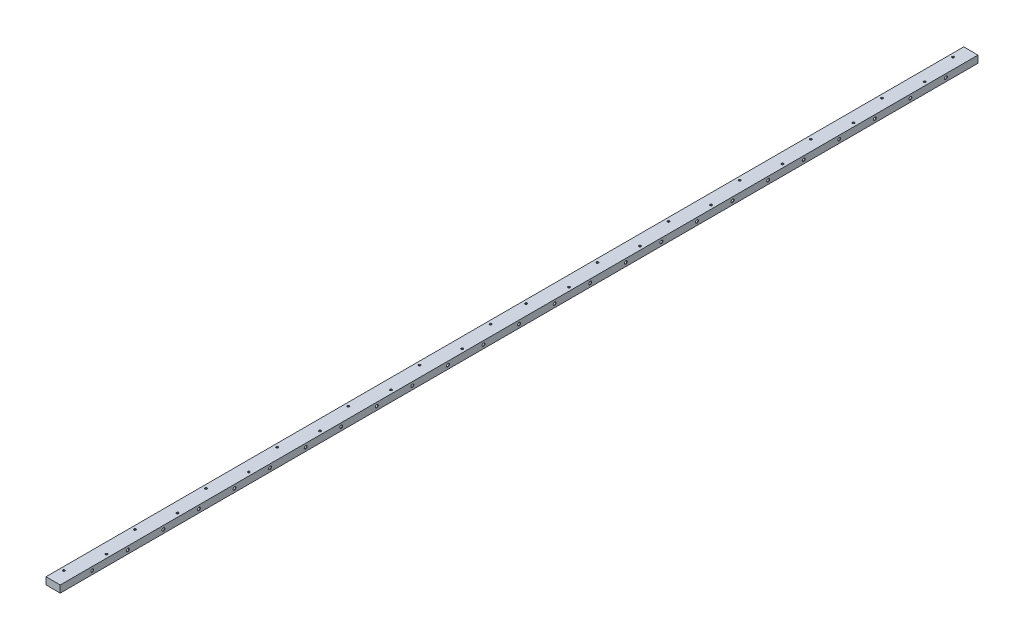
from build123d import *

# Parameters (mm, degrees)
SKETCH1_W                      = 20
SKETCH1_H                      = 10
BOSS_EXTRUDE1_DEPTH            = 645
M3X0_5_TAPPED_HOLE1_AT_2_COUNT = 2
M3X0_5_TAPPED_HOLE1_AT_2_PITCH = 50.990195136
LPATTERN1_COUNT                = 7
LPATTERN1_PITCH                = 100
LPATTERN2_COUNT                = 13
LPATTERN2_PITCH                = 50
LPATTERN2_COL_COUNT            = 13
LPATTERN2_COL_PITCH            = 50


with BuildPart() as part:
    # Sketch1 → Boss-Extrude1 (new, symmetric)
    with BuildSketch(Plane.XY):
        Rectangle(SKETCH1_W, SKETCH1_H)
    extrude(amount=BOSS_EXTRUDE1_DEPTH, both=True)

    # Sketch7 → M3x0.5 Tapped Hole1 (revolve, cut)
    with BuildSketch(Plane(origin=(-5, 5, 25), x_dir=(0, 0, 1), z_dir=(1, 0, 0))):
        Polygon((0, 0), (0, 8.751075774), (1.25, 8), (1.25, 0.66390873), (1.525, 0), align=None)
    m3x0_5_tapped_hole1 = revolve(axis=Axis((-5, 11.35, 25), (0, -1, 0)), mode=Mode.SUBTRACT)

    # M3x0.5 Tapped Hole1 at 2: M3x0.5 Tapped Hole1 ×2
    with Locations(*[Vector(0.1961161351381841, 0, 0.9805806756909201) * (i * M3X0_5_TAPPED_HOLE1_AT_2_PITCH) for i in range(1, M3X0_5_TAPPED_HOLE1_AT_2_COUNT)]):
        add(m3x0_5_tapped_hole1, mode=Mode.SUBTRACT)

    # LPattern1: M3x0.5 Tapped Hole1 ×7
    with Locations(*[(0, 0, i * LPATTERN1_PITCH) for i in range(1, LPATTERN1_COUNT)]):
        add(m3x0_5_tapped_hole1, mode=Mode.SUBTRACT)

    # LPattern1 copy 1 sketch → LPattern1 copy 1 (revolve, cut)
    with BuildSketch(Plane(origin=(5, 5, 175), x_dir=(0, 0, 1), z_dir=(1, 0, 0))):
        Polygon((0, 0), (0, 8.751075774), (1.25, 8), (1.25, 0.66390873), (1.525, 0), align=None)
    revolve(axis=Axis((5, 11.35, 175), (0, -1, 0)), mode=Mode.SUBTRACT)

    # LPattern1 copy 2 sketch → LPattern1 copy 2 (revolve, cut)
    with BuildSketch(Plane(origin=(5, 5, 275), x_dir=(0, 0, 1), z_dir=(1, 0, 0))):
        Polygon((0, 0), (0, 8.751075774), (1.25, 8), (1.25, 0.66390873), (1.525, 0), align=None)
    revolve(axis=Axis((5, 11.35, 275), (0, -1, 0)), mode=Mode.SUBTRACT)

    # LPattern1 copy 3 sketch → LPattern1 copy 3 (revolve, cut)
    with BuildSketch(Plane(origin=(5, 5, 375), x_dir=(0, 0, 1), z_dir=(1, 0, 0))):
        Polygon((0, 0), (0, 8.751075774), (1.25, 8), (1.25, 0.66390873), (1.525, 0), align=None)
    revolve(axis=Axis((5, 11.35, 375), (0, -1, 0)), mode=Mode.SUBTRACT)

    # LPattern1 copy 4 sketch → LPattern1 copy 4 (revolve, cut)
    with BuildSketch(Plane(origin=(5, 5, 475), x_dir=(0, 0, 1), z_dir=(1, 0, 0))):
        Polygon((0, 0), (0, 8.751075774), (1.25, 8), (1.25, 0.66390873), (1.525, 0), align=None)
    revolve(axis=Axis((5, 11.35, 475), (0, -1, 0)), mode=Mode.SUBTRACT)

    # LPattern1 copy 5 sketch → LPattern1 copy 5 (revolve, cut)
    with BuildSketch(Plane(origin=(5, 5, 575), x_dir=(0, 0, 1), z_dir=(1, 0, 0))):
        Polygon((0, 0), (0, 8.751075774), (1.25, 8), (1.25, 0.66390873), (1.525, 0), align=None)
    revolve(axis=Axis((5, 11.35, 575), (0, -1, 0)), mode=Mode.SUBTRACT)

    # LPattern1 copy 6 sketch → LPattern1 copy 6 (revolve, cut)
    with BuildSketch(Plane(origin=(5, 5, 675), x_dir=(0, 0, 1), z_dir=(1, 0, 0))):
        Polygon((0, 0), (0, 8.751075774), (1.25, 8), (1.25, 0.66390873), (1.525, 0), align=None)
    revolve(axis=Axis((5, 11.35, 675), (0, -1, 0)), mode=Mode.SUBTRACT)

    # Mirror1: M3x0.5 Tapped Hole1 across plane
    add(m3x0_5_tapped_hole1.mirror(Plane.XY), mode=Mode.SUBTRACT)

    # Mirror1 copy 1 sketch → Mirror1 copy 1 (revolve, cut)
    with BuildSketch(Plane(origin=(5, 5, -75), x_dir=(0, 0, -1), z_dir=(1, 0, 0))):
        Polygon((0, 0), (0, -8.751075774), (1.25, -8), (1.25, -0.66390873), (1.525, 0), align=None)
    revolve(axis=Axis((5, 11.35, -75), (0, 1, 0)), mode=Mode.SUBTRACT)

    # Mirror1 copy 2 sketch → Mirror1 copy 2 (revolve, cut)
    with BuildSketch(Plane(origin=(-5, 5, -125), x_dir=(0, 0, -1), z_dir=(1, 0, 0))):
        Polygon((0, 0), (0, -8.751075774), (1.25, -8), (1.25, -0.66390873), (1.525, 0), align=None)
    revolve(axis=Axis((-5, 11.35, -125), (0, 1, 0)), mode=Mode.SUBTRACT)

    # Mirror1 copy 3 sketch → Mirror1 copy 3 (revolve, cut)
    with BuildSketch(Plane(origin=(-5, 5, -225), x_dir=(0, 0, -1), z_dir=(1, 0, 0))):
        Polygon((0, 0), (0, -8.751075774), (1.25, -8), (1.25, -0.66390873), (1.525, 0), align=None)
    revolve(axis=Axis((-5, 11.35, -225), (0, 1, 0)), mode=Mode.SUBTRACT)

    # Mirror1 copy 4 sketch → Mirror1 copy 4 (revolve, cut)
    with BuildSketch(Plane(origin=(-5, 5, -325), x_dir=(0, 0, -1), z_dir=(1, 0, 0))):
        Polygon((0, 0), (0, -8.751075774), (1.25, -8), (1.25, -0.66390873), (1.525, 0), align=None)
    revolve(axis=Axis((-5, 11.35, -325), (0, 1, 0)), mode=Mode.SUBTRACT)

    # Mirror1 copy 5 sketch → Mirror1 copy 5 (revolve, cut)
    with BuildSketch(Plane(origin=(-5, 5, -425), x_dir=(0, 0, -1), z_dir=(1, 0, 0))):
        Polygon((0, 0), (0, -8.751075774), (1.25, -8), (1.25, -0.66390873), (1.525, 0), align=None)
    revolve(axis=Axis((-5, 11.35, -425), (0, 1, 0)), mode=Mode.SUBTRACT)

    # Mirror1 copy 6 sketch → Mirror1 copy 6 (revolve, cut)
    with BuildSketch(Plane(origin=(-5, 5, -525), x_dir=(0, 0, -1), z_dir=(1, 0, 0))):
        Polygon((0, 0), (0, -8.751075774), (1.25, -8), (1.25, -0.66390873), (1.525, 0), align=None)
    revolve(axis=Axis((-5, 11.35, -525), (0, 1, 0)), mode=Mode.SUBTRACT)

    # Mirror1 copy 7 sketch → Mirror1 copy 7 (revolve, cut)
    with BuildSketch(Plane(origin=(-5, 5, -625), x_dir=(0, 0, -1), z_dir=(1, 0, 0))):
        Polygon((0, 0), (0, -8.751075774), (1.25, -8), (1.25, -0.66390873), (1.525, 0), align=None)
    revolve(axis=Axis((-5, 11.35, -625), (0, 1, 0)), mode=Mode.SUBTRACT)

    # Mirror1 copy 8 sketch → Mirror1 copy 8 (revolve, cut)
    with BuildSketch(Plane(origin=(5, 5, -175), x_dir=(0, 0, -1), z_dir=(1, 0, 0))):
        Polygon((0, 0), (0, -8.751075774), (1.25, -8), (1.25, -0.66390873), (1.525, 0), align=None)
    revolve(axis=Axis((5, 11.35, -175), (0, 1, 0)), mode=Mode.SUBTRACT)

    # Mirror1 copy 9 sketch → Mirror1 copy 9 (revolve, cut)
    with BuildSketch(Plane(origin=(5, 5, -275), x_dir=(0, 0, -1), z_dir=(1, 0, 0))):
        Polygon((0, 0), (0, -8.751075774), (1.25, -8), (1.25, -0.66390873), (1.525, 0), align=None)
    revolve(axis=Axis((5, 11.35, -275), (0, 1, 0)), mode=Mode.SUBTRACT)

    # Mirror1 copy 10 sketch → Mirror1 copy 10 (revolve, cut)
    with BuildSketch(Plane(origin=(5, 5, -375), x_dir=(0, 0, -1), z_dir=(1, 0, 0))):
        Polygon((0, 0), (0, -8.751075774), (1.25, -8), (1.25, -0.66390873), (1.525, 0), align=None)
    revolve(axis=Axis((5, 11.35, -375), (0, 1, 0)), mode=Mode.SUBTRACT)

    # Mirror1 copy 11 sketch → Mirror1 copy 11 (revolve, cut)
    with BuildSketch(Plane(origin=(5, 5, -475), x_dir=(0, 0, -1), z_dir=(1, 0, 0))):
        Polygon((0, 0), (0, -8.751075774), (1.25, -8), (1.25, -0.66390873), (1.525, 0), align=None)
    revolve(axis=Axis((5, 11.35, -475), (0, 1, 0)), mode=Mode.SUBTRACT)

    # Mirror1 copy 12 sketch → Mirror1 copy 12 (revolve, cut)
    with BuildSketch(Plane(origin=(5, 5, -575), x_dir=(0, 0, -1), z_dir=(1, 0, 0))):
        Polygon((0, 0), (0, -8.751075774), (1.25, -8), (1.25, -0.66390873), (1.525, 0), align=None)
    revolve(axis=Axis((5, 11.35, -575), (0, 1, 0)), mode=Mode.SUBTRACT)

    # Mirror1 copy 13 sketch → Mirror1 copy 13 (revolve, cut)
    with BuildSketch(Plane(origin=(5, 5, -675), x_dir=(0, 0, -1), z_dir=(1, 0, 0))):
        Polygon((0, 0), (0, -8.751075774), (1.25, -8), (1.25, -0.66390873), (1.525, 0), align=None)
    revolve(axis=Axis((5, 11.35, -675), (0, 1, 0)), mode=Mode.SUBTRACT)

    # Sketch9 → M4x0.7 Tapped Hole1 (revolve, cut)
    with BuildSketch(Plane(origin=(-10, 0, 0), x_dir=(0, 0, 1), z_dir=(0, 1, 0))):
        Polygon((0, 0), (0, 20), (2.05, 20), (1.65, 19.6), (1.65, 0.4), (2.05, 0), align=None)
    m4x0_7_tapped_hole1 = revolve(axis=Axis((-16.35, 0, 0), (1, 0, 0)), mode=Mode.SUBTRACT)

    # LPattern2: M4x0.7 Tapped Hole1 ×13
    with Locations(*[(0, 0, i * LPATTERN2_PITCH) for i in range(1, LPATTERN2_COUNT)]):
        add(m4x0_7_tapped_hole1, mode=Mode.SUBTRACT)

    # LPattern2 col: M4x0.7 Tapped Hole1 ×13
    with Locations(*[(0, 0, -i * LPATTERN2_COL_PITCH) for i in range(1, LPATTERN2_COL_COUNT)]):
        add(m4x0_7_tapped_hole1, mode=Mode.SUBTRACT)


solid = part.part
